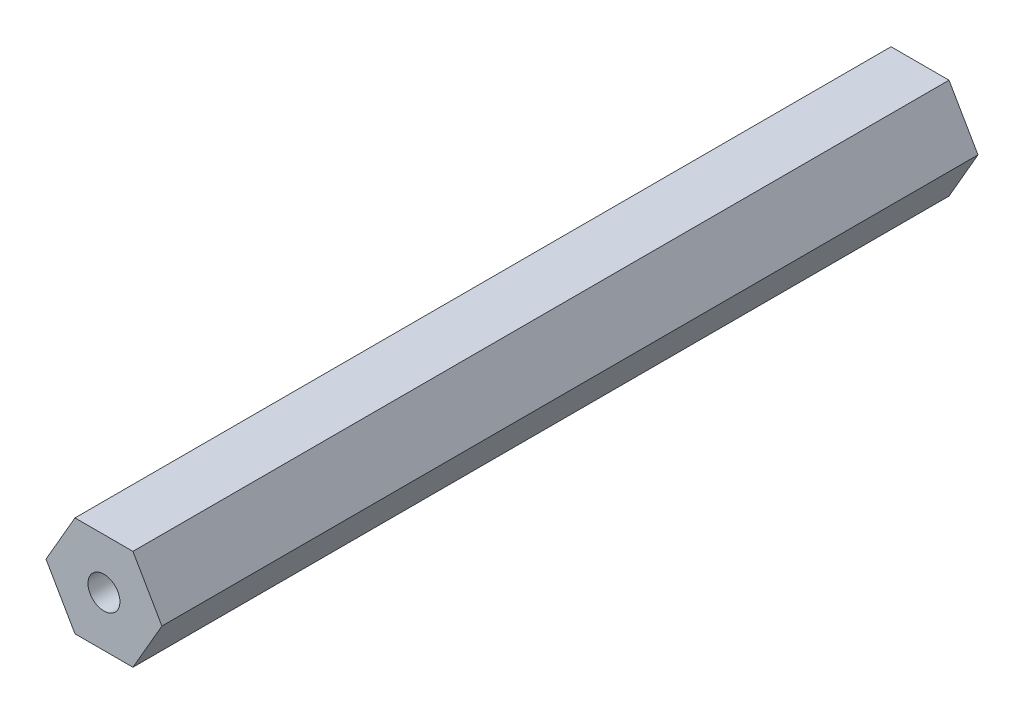
from build123d import *

# Parameters (mm, degrees)
SKETCH1_R           = 4.7625
SKETCH1_R_2         = 2.0193
BOSS_EXTRUDE1_DEPTH = 103.251
SKETCH2_R           = 4.7625
BOSS_EXTRUDE2_DEPTH = 103.251


with BuildPart() as part:
    # Sketch1 → Boss-Extrude1 (new body)
    with BuildSketch(Plane.XY):
        Circle(SKETCH1_R)
        Circle(SKETCH1_R_2, mode=Mode.SUBTRACT)
    extrude(amount=BOSS_EXTRUDE1_DEPTH)

    # Sketch2 → Boss-Extrude2 (add, through all)
    with BuildSketch(Plane.XY.offset(103.251)):
        Polygon((7.332348419, 0), (3.666174209, 6.35), (-3.666174209, 6.35), (-7.332348419, 0), (-3.666174209, -6.35), (3.666174209, -6.35), align=None)
        Circle(SKETCH2_R, mode=Mode.SUBTRACT)
    extrude(amount=-BOSS_EXTRUDE2_DEPTH)


solid = part.part
